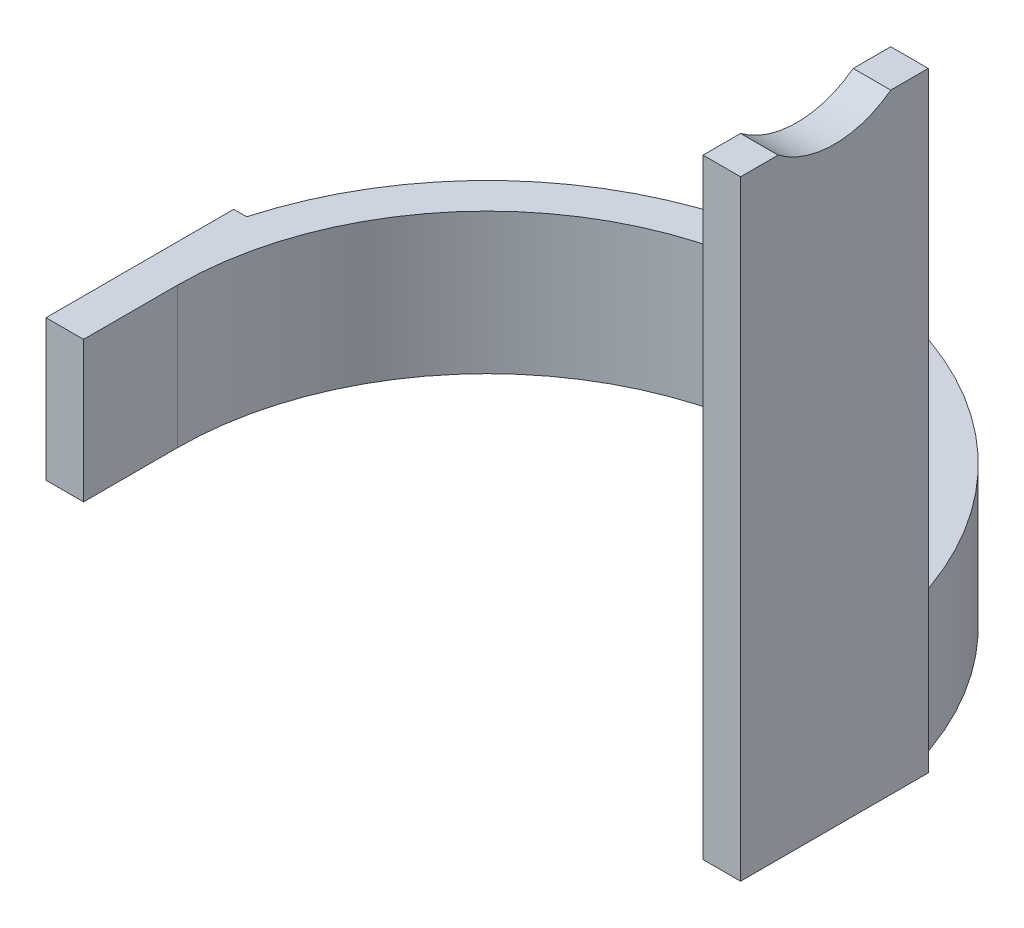
from build123d import *

# Parameters (mm, degrees)
EXTRUDE_1_DEPTH     = 30
SKETCH_2_W          = 8
SKETCH_2_H          = 40
EXTRUDE_2_DEPTH     = 100
SKETCH_3_R          = 20
CUT_EXTRUDE_1_DEPTH = 211.428135001
SKETCH_4_W          = 49.783903804
SKETCH_4_H          = 106.145914561
CUT_EXTRUDE_3_DEPTH = 10


with BuildPart() as part:
    # 草图1 → 凸台-拉伸1 (new body)
    with BuildSketch(Plane(origin=(0, 0, 0), x_dir=(1, 0, 0), z_dir=(0, 1, 0))):
        with BuildLine():
            Line((-74, 20), (-71.246052522, 20))
            ThreePointArc((-71.246052522, 20), (0, 74), (71.246052522, 20))
            Line((71.246052522, 20), (74, 20))
            Line((74, 20), (74, -20))
            Line((74, -20), (66, -20))
            Line((66, -20), (66, 0))
            ThreePointArc((66, 0), (0, 66), (-66, 0))
            Line((-66, 0), (-66, -20))
            Line((-66, -20), (-74, -20))
            Line((-74, -20), (-74, 20))
        make_face()
    extrude(amount=EXTRUDE_1_DEPTH)

    # 草图2 → 凸台-拉伸2 (add)
    with BuildSketch(Plane(origin=(0, 30, 0), x_dir=(1, 0, 0), z_dir=(0, 1, 0))):
        with Locations((-70, 0)):
            Rectangle(SKETCH_2_W, SKETCH_2_H)
        with Locations((70, 0)):
            Rectangle(SKETCH_2_W, SKETCH_2_H)
    extrude(amount=EXTRUDE_2_DEPTH)

    # 草图3 → 切除-拉伸1 (cut, through all)
    with BuildSketch(Plane.ZY.offset(74)):
        with Locations((0, 146)):
            Circle(SKETCH_3_R)
    extrude(amount=-CUT_EXTRUDE_1_DEPTH, mode=Mode.SUBTRACT)

    # 草图4 → 切除-拉伸3 (cut)
    with BuildSketch(Plane.ZY.offset(74)):
        with Locations((4.891951902, 83.072957281)):
            Rectangle(SKETCH_4_W, SKETCH_4_H)
    extrude(amount=-CUT_EXTRUDE_3_DEPTH, mode=Mode.SUBTRACT)


solid = part.part
